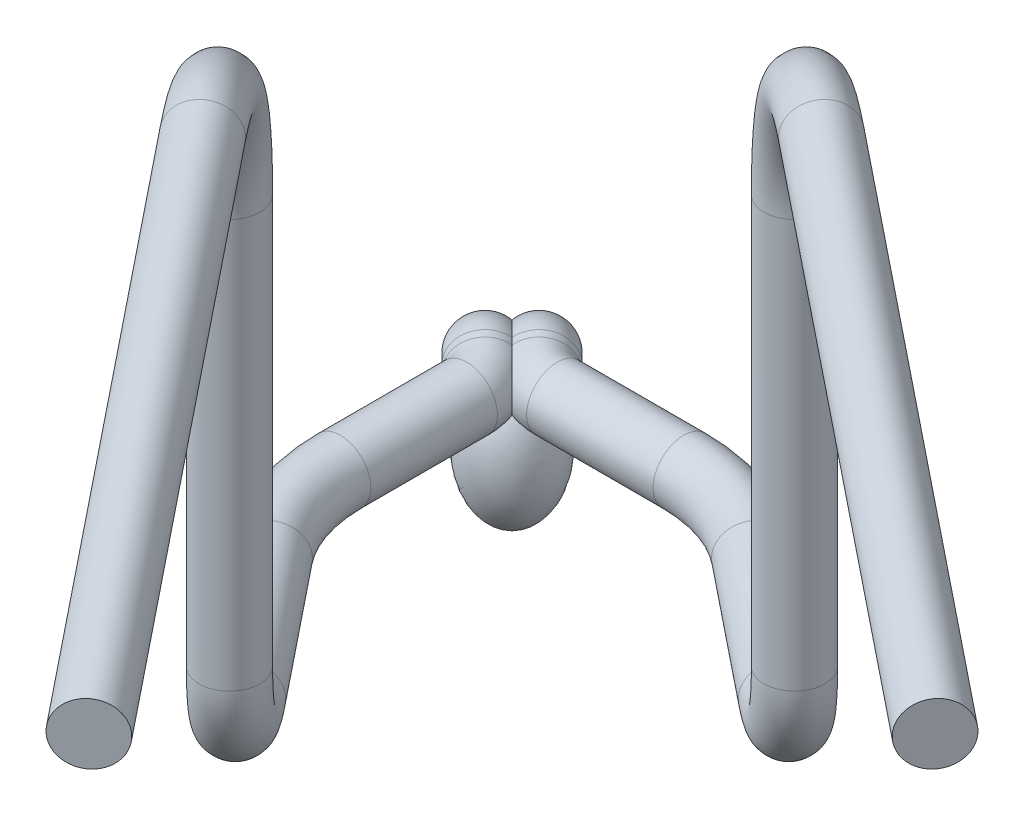
from build123d import *

# Parameters (mm, degrees)
SKETCH2_R = 0.35


with BuildPart() as part:
    # Sweep1: sweep along a curve in space
    with BuildLine() as sweep1_path:
        Line((-1.964325191, -0.5, -2.27496459), (-1.964325191, -0.665589347, -2.27496459))
        ThreePointArc((-1.610771801, 0, -1.921411199), (-1.860771801, -0.146446609, -2.171411199), (-1.964325191, -0.5, -2.27496459))
        Line((-1.610771801, 0, -1.921411199), (-1.536637852, 0, -1.847277251))
        ThreePointArc((-1.536637852, 0, -1.847277251), (-1.374426178, 0, -1.738890875), (-1.183084462, 0, -1.700830641))
        Line((-1.183084462, 0, -1.700830641), (0.267695477, 0, -1.700830641))
        ThreePointArc((0.267695477, 0, -1.700830641), (0.931127774, 0, -1.587589128), (1.519431994, 0, -1.260688228))
        Line((1.519431994, 0, -1.260688228), (3.068038044, 0, -0.017980713))
        ThreePointArc((3.068038044, 0, -0.017980713), (3.619530983, 0.292893219, 0.424574977), (3.847966837, 1, 0.607887545))
        Line((3.847966837, 1, 0.607887545), (3.847966837, 5.684839104, 0.607887545))
        ThreePointArc((3.847966837, 5.684839104, 0.607887545), (4.304838547, 7.099052666, 0.974512683), (5.407824424, 7.684839104, 1.859624063))
        Line((5.407824424, 7.684839104, 1.859624063), (12.009648162, 7.684839104, 7.157379402))
    # Sketch2 → Sweep1 (sweep)
    with BuildSketch(Plane(origin=(12.009648162, 7.684839104, 7.157379402), x_dir=(0.6258682588458945, 0, -0.7799287932684679), z_dir=(0.7799287932684679, 0, 0.6258682588458945))):
        Circle(SKETCH2_R)
    sweep(path=sweep1_path.line)


with BuildPart() as body_2:
    # Mirror3: mirrored copy
    add(part.part.mirror(Plane(origin=(0, 0, 0), x_dir=(0.7071067811865439, 0, 0.7071067811865512), z_dir=(-0.7071067811865513, 0, 0.7071067811865438))))


with BuildPart() as body_3:
    # Sketch4 → Revolve1 (revolve)
    with BuildSketch(Plane(origin=(0, 0, 0), x_dir=(0.7071067811865438, 0, 0.7071067811865513), z_dir=(-0.7071067811865513, 0, 0.7071067811865438))):
        with BuildLine():
            Line((-3, -0.425178219), (-3, -1.925178219))
            add(Edge.make_bspline(
                [(-3, -0.425178219), (-3.5, -0.425178219), (-3.5, -1.175178219), (-3.5, -1.925178219), (-3, -1.925178219)],
                knots=[3.141592654, 3.141592654, 3.141592654, 4.71238898, 4.71238898, 6.283185307, 6.283185307, 6.283185307], degree=2, weights=[1, 0.707106781, 1, 0.707106781, 1]))
        make_face()
    revolve(axis=Axis((-2.121320344, -0.425178219, -2.121320344), (0, -1, 0)))


solid = Compound([part.part, body_2.part, body_3.part])
